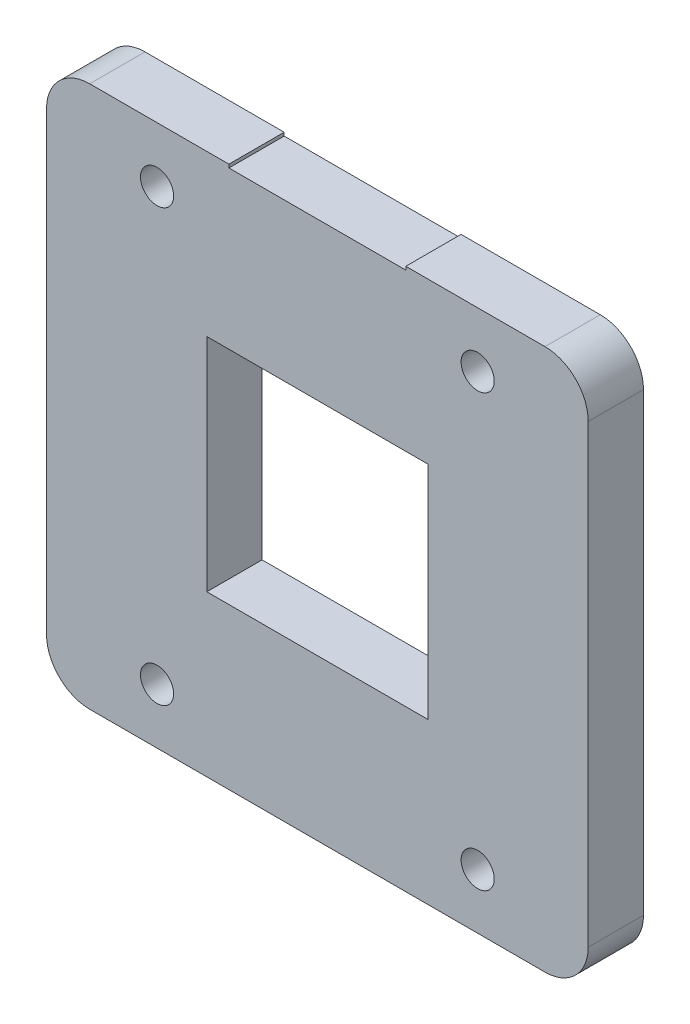
from build123d import *

# Parameters (mm, degrees)
BOSS_EXTRUDE1_DEPTH = 5
SKETCH2_W           = 20
SKETCH2_H           = 20
CUT_EXTRUDE1_DEPTH  = 5
SKETCH5_R           = 1.5
CUT_EXTRUDE2_DEPTH  = 36.007142128
SKETCH6_W           = 16
SKETCH6_H           = 0.8
CUT_EXTRUDE3_DEPTH  = 36.007142128


with BuildPart() as part:
    # Sketch1 → Boss-Extrude1 (new body)
    with BuildSketch(Plane.XY):
        with BuildLine():
            Line((20.59, 24.5), (-20.59, 24.5))
            ThreePointArc((-20.59, 24.5), (-23.354787514, 23.354787514), (-24.5, 20.59))
            Line((-24.5, 20.59), (-24.5, -20.59))
            ThreePointArc((-24.5, -20.59), (-23.354787514, -23.354787514), (-20.59, -24.5))
            Line((-20.59, -24.5), (20.59, -24.5))
            ThreePointArc((20.59, -24.5), (23.354787514, -23.354787514), (24.5, -20.59))
            Line((24.5, -20.59), (24.5, 20.59))
            ThreePointArc((24.5, 20.59), (23.354787514, 23.354787514), (20.59, 24.5))
        make_face()
    extrude(amount=BOSS_EXTRUDE1_DEPTH)

    # Sketch2 → Cut-Extrude1 (cut)
    with BuildSketch(Plane.XY.offset(5)):
        Rectangle(SKETCH2_W, SKETCH2_H)
    extrude(amount=-CUT_EXTRUDE1_DEPTH, mode=Mode.SUBTRACT)

    # Sketch5 → Cut-Extrude2 (cut, through all)
    with BuildSketch(Plane.XY.offset(5)):
        with Locations((-14.5, 19.5)):
            Circle(SKETCH5_R)
        with Locations((14.5, 19.5)):
            Circle(SKETCH5_R)
        with Locations((-14.5, -19.5)):
            Circle(SKETCH5_R)
        with Locations((14.5, -19.5)):
            Circle(SKETCH5_R)
    extrude(amount=-CUT_EXTRUDE2_DEPTH, mode=Mode.SUBTRACT)

    # Sketch6 → Cut-Extrude3 (cut, through all)
    with BuildSketch(Plane(origin=(0, 0, 0), x_dir=(-1, 0, 0), z_dir=(0, 0, -1))):
        with Locations((0, 24.6)):
            Rectangle(SKETCH6_W, SKETCH6_H)
    extrude(amount=-CUT_EXTRUDE3_DEPTH, mode=Mode.SUBTRACT)


solid = part.part
